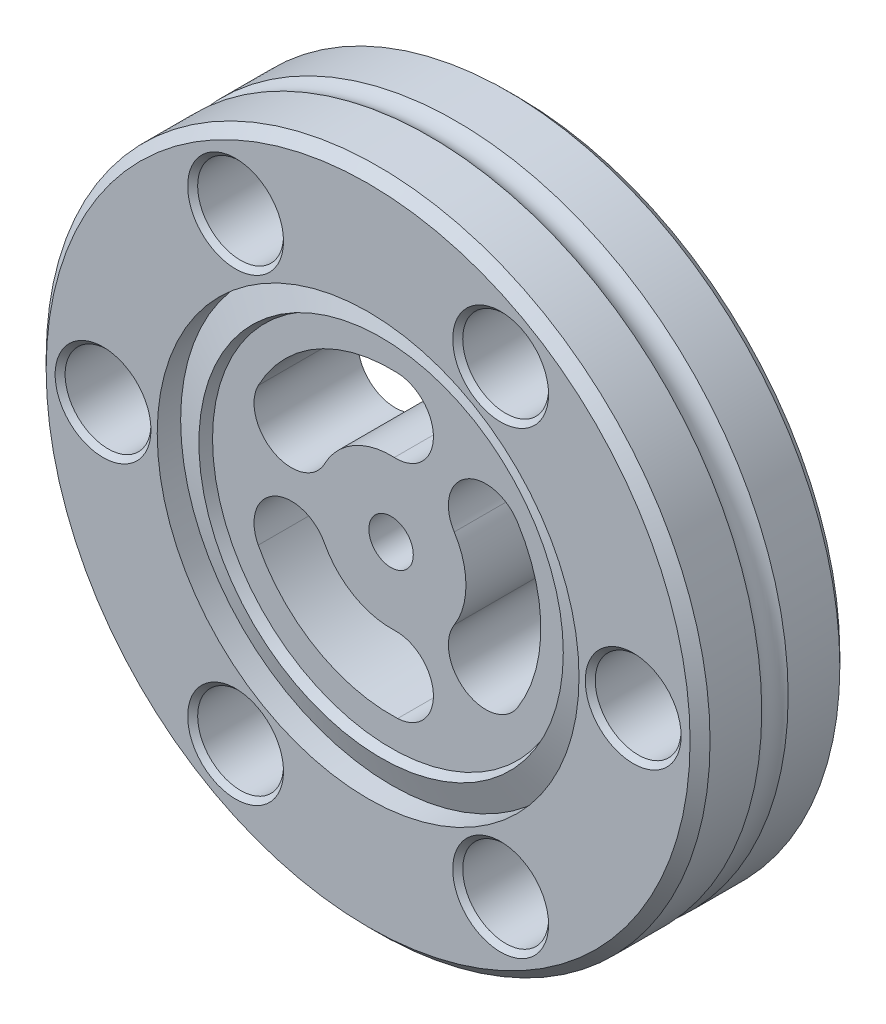
from build123d import *

# Parameters (mm, degrees)
M4_CLEARANCE_HOLE1_D      = 4.3688
M4_CLEARANCE_HOLE2_D      = 4.3688
CHAMFER1_SIZE             = 0.254
CHAMFER2_SIZE             = 0.508
TAP_DRILL_FOR_4_40_TAP1_D = 2.2606
CUT_EXTRUDE1_DEPTH        = 25.743381025
CIRPATTERN1_COUNT         = 3


with BuildPart() as part:
    # Sketch1 → Revolve1 (revolve)
    with BuildSketch(Plane(origin=(0, 0, 0), x_dir=(1, 0, 0), z_dir=(0, 1, 0))):
        with BuildLine():
            Line((9.086103121, 2.6416), (0, 2.6416))
            Line((0, 2.6416), (0, -2.6416))
            Line((0, -2.6416), (9.086103121, -2.6416))
            Line((9.086103121, -2.6416), (9.271, -3.1496))
            Line((9.271, -3.1496), (10.7315, -2.618021473))
            Line((10.7315, -2.618021473), (10.7315, -3.81))
            Line((10.7315, -3.81), (16.891, -3.81))
            Line((16.891, -3.81), (16.891, -0.672020833))
            ThreePointArc((16.891, -0.672020833), (16.637, 0), (16.891, 0.672020833))
            Line((16.891, 0.672020833), (16.891, 3.81))
            Line((16.891, 3.81), (10.7315, 3.81))
            Line((10.7315, 3.81), (10.7315, 2.618021473))
            Line((10.7315, 2.618021473), (9.271, 3.1496))
            Line((9.271, 3.1496), (9.086103121, 2.6416))
        make_face()
    revolve(axis=Axis((0, 0, -3.81), (0, 0, 1)))

    # M4 Clearance Hole1 (through all)
    with Locations(Plane(origin=(0, 0, -3.81), x_dir=(-1, 0, 0), z_dir=(0, 0, -1))):
        with Locations((6.7437, -11.680431031), (6.7437, 11.680431031), (-6.7437, 11.680431031), (-13.4874, 0)):
            Hole(M4_CLEARANCE_HOLE1_D / 2)

    # M4 Clearance Hole2 (through all)
    with Locations(Plane.XY.offset(3.81)):
        with Locations((6.7437, -11.680431031), (-13.4874, 0)):
            Hole(M4_CLEARANCE_HOLE2_D / 2)

    # Chamfer1
    chamfer1_edges = [part.edges().sort_by_distance(p)[0] for p in [
        (11.303, 0, -3.81),
        (11.303, 0, 3.81),
        (4.5593, 11.680431031, -3.81),
        (4.5593, 11.680431031, 3.81),
        (-8.9281, 11.680431031, -3.81),
        (-8.9281, 11.680431031, 3.81),
        (-8.9281, -11.680431031, -3.81),
        (-8.9281, -11.680431031, 3.81),
        (-11.303, 0, 3.81),
        (-11.303, 0, -3.81),
        (8.9281, -11.680431031, 3.81),
        (8.9281, -11.680431031, -3.81),
    ]]
    chamfer(chamfer1_edges, length=CHAMFER1_SIZE)

    # Chamfer2
    chamfer2_edges = [part.edges().sort_by_distance(p)[0] for p in [
        (-16.891, 0, 3.81),
        (-16.891, 0, -3.81),
    ]]
    chamfer(chamfer2_edges, length=CHAMFER2_SIZE)

    # Tap Drill for #4-40 Tap1 (through all)
    with Locations(Plane(origin=(0, 0, -2.6416), x_dir=(-1, 0, 0), z_dir=(0, 0, -1))):
        with Locations((0, 0)):
            Hole(TAP_DRILL_FOR_4_40_TAP1_D / 2)

    # Sketch10 → Cut-Extrude1 (cut, through all)
    with BuildSketch(Plane.XY.offset(2.6416)):
        with BuildLine():
            ThreePointArc((6.426642817, -4.094223016), (7.62, 0), (6.426642817, 4.094223016))
            ThreePointArc((6.426642817, 4.094223016), (3.796426359, 4.677327966), (3.213321409, 2.047111508))
            ThreePointArc((3.213321409, 2.047111508), (3.81, 0), (3.213321409, -2.047111508))
            ThreePointArc((3.213321409, -2.047111508), (3.796426359, -4.677327966), (6.426642817, -4.094223016))
        make_face()
    cut_extrude1 = extrude(amount=-CUT_EXTRUDE1_DEPTH, mode=Mode.SUBTRACT)

    # CirPattern1: Cut-Extrude1 ×3 about axis
    cirpattern1_axis = Axis((0, 0, 0), (0, 0, 1))
    for i in range(1, CIRPATTERN1_COUNT):
        add(cut_extrude1.rotate(cirpattern1_axis, i * 360 / CIRPATTERN1_COUNT), mode=Mode.SUBTRACT)


solid = part.part
